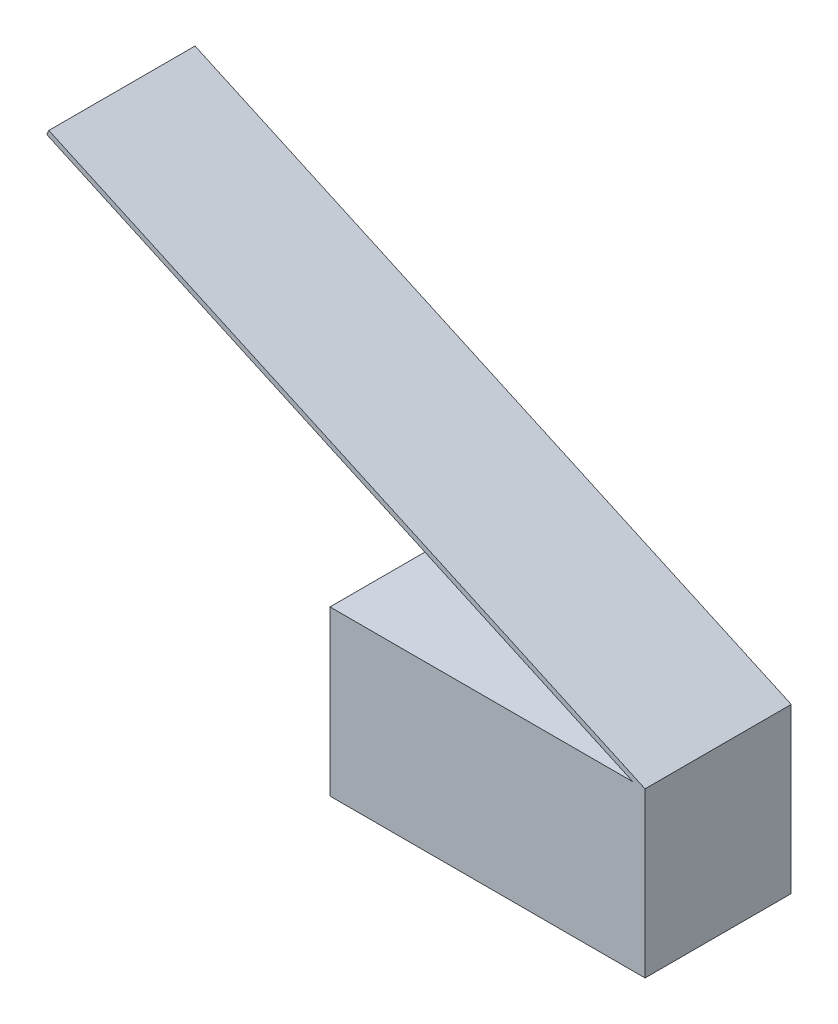
from build123d import *

# Parameters (mm, degrees)
SKETCH_1_W      = 12.5
SKETCH_1_H      = 5.8
EXTRUDE_1_DEPTH = 6.5
EXTRUDE_2_DEPTH = 5.8


with BuildPart() as part:
    # 草图1 → 凸台-拉伸1 (new body)
    with BuildSketch(Plane(origin=(0, 0, 0), x_dir=(1, 0, 0), z_dir=(0, 1, 0))):
        with Locations((-0.217181467, -0.076640927)):
            Rectangle(SKETCH_1_W, SKETCH_1_H)
    extrude(amount=EXTRUDE_1_DEPTH)

    # 草图2 → 凸台-拉伸2 (add, through all)
    with BuildSketch(Plane.XY.offset(2.976640927)):
        Polygon((6.032818533, 6.5), (-17.62035358, 17.294788047), (-17.703390412, 17.112840569), (5.551104582, 6.5), align=None)
    extrude(amount=-EXTRUDE_2_DEPTH)


solid = part.part
